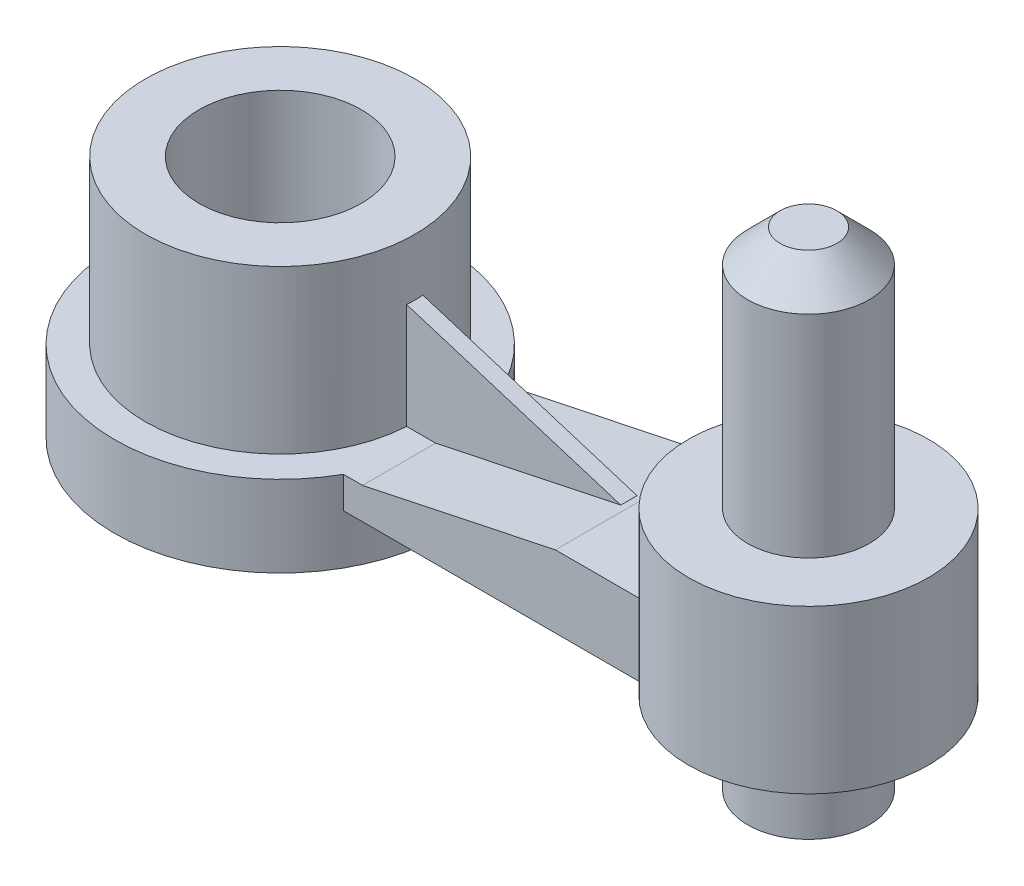
from build123d import *

# Parameters (mm, degrees)
CROQUIS1_R               = 8.295
CROQUIS1_R_2             = 5
SALIENTE_EXTRUIR1_DEPTH  = 10
CROQUIS2_R               = 10.195
SALIENTE_EXTRUIR2_DEPTH  = 5
CROQUIS5_R               = 3.745
SALIENTE_EXTRUIR3_DEPTH  = 2.5
CROQUIS6_R               = 7.385
SALIENTE_EXTRUIR4_DEPTH  = 10
CROQUIS7_R               = 3.745
CORTAR_EXTRUIR3_DEPTH    = 10
CROQUIS8_R               = 3.745
SALIENTE_EXTRUIR5_DEPTH  = 23
CROQUIS9_R               = 3.745
SALIENTE_EXTRUIR6_DEPTH  = 2
SALIENTE_EXTRUIR6_TAPER  = 45
SALIENTE_EXTRUIR16_DEPTH = 5
SALIENTE_EXTRUIR19_DEPTH = 0.5
SALIENTE_EXTRUIR20_DEPTH = 5


with BuildPart() as part:
    # Croquis1 → Saliente-Extruir1 (new body)
    with BuildSketch(Plane(origin=(0, 0, 0), x_dir=(1, 0, 0), z_dir=(0, 1, 0))):
        with Locations(Location((-17.319844218, -0.612730338, 0), (0, 0, 270))):
            Circle(CROQUIS1_R)
        with Locations(Location((-17.319844218, -0.612730338, 0), (0, 0, 270))):
            Circle(CROQUIS1_R_2, mode=Mode.SUBTRACT)
    extrude(amount=SALIENTE_EXTRUIR1_DEPTH)

    # Croquis2 → Saliente-Extruir2 (add)
    with BuildSketch(Plane.XZ):
        with Locations(Location((-17.319844218, 0.612730338, 0), (0, 0, 270))):
            Circle(CROQUIS2_R)
    extrude(amount=SALIENTE_EXTRUIR2_DEPTH)



with BuildPart() as body_2:
    # Croquis5 → Saliente-Extruir3 (new, symmetric)
    with BuildSketch(Plane.XZ.offset(5)):
        with Locations(Location((15.200155782, 0.612730338, 0), (0, 0, 270))):
            Circle(CROQUIS5_R)
    extrude(amount=SALIENTE_EXTRUIR3_DEPTH, both=True)

    # Croquis6 → Saliente-Extruir4 (add)
    with BuildSketch(Plane(origin=(0, -2.5, 0), x_dir=(1, 0, 0), z_dir=(0, 1, 0))):
        with Locations(Location((15.200155782, -0.612730338, 0), (0, 0, 270))):
            Circle(CROQUIS6_R)
    extrude(amount=SALIENTE_EXTRUIR4_DEPTH)

    # Croquis7 → Cortar-Extruir3 (cut)
    with BuildSketch(Plane.XZ.offset(2.5)):
        with Locations(Location((15.200155782, 0.612730338, 0), (0, 0, 270))):
            Circle(CROQUIS7_R)
    extrude(amount=-CORTAR_EXTRUIR3_DEPTH, mode=Mode.SUBTRACT)


with BuildPart() as cortar_extruir3_piece_1:
    # of the separate pieces the step leaves, piece 1, a body of its own (cortar_extruir3_pieces)
    add(body_2.part.solids().sort_by_distance((15.200155782, -2.5, 7.997730338))[0])



with BuildPart() as cortar_extruir3_piece_2:
    # of the separate pieces the step leaves, piece 2, a body of its own (cortar_extruir3_pieces)
    add(body_2.part.solids().sort_by_distance((15.200155782, -7.5, -3.132269662))[0])


with BuildPart() as cortar_extruir3_piece_1_1:
    add(cortar_extruir3_piece_1.part)

    add(cortar_extruir3_piece_2.part)  # Saliente-Extruir5 merges Cortar-Extruir3 piece 2
    # Croquis8 → Saliente-Extruir5 (add)
    with BuildSketch(Plane(origin=(0, -2.5, 0), x_dir=(1, 0, 0), z_dir=(0, 1, 0))):
        with Locations(Location((15.200155782, -0.612730338, 0), (0, 0, 270))):
            Circle(CROQUIS8_R)
    extrude(amount=SALIENTE_EXTRUIR5_DEPTH)


with BuildPart() as body_3:
    # Croquis9 → Saliente-Extruir6 (new body)
    with BuildSketch(Plane(origin=(0, 20.5, 0), x_dir=(1, 0, 0), z_dir=(0, 1, 0))):
        with Locations(Location((15.200155782, -0.612730338, 0), (0, 0, 270))):
            Circle(CROQUIS9_R)
    extrude(amount=SALIENTE_EXTRUIR6_DEPTH, taper=SALIENTE_EXTRUIR6_TAPER)


with BuildPart() as part_1:
    add(part.part)

    add(cortar_extruir3_piece_1_1.part)  # Saliente-Extruir16 merges Cortar-Extruir3 piece 1
    # Croquis20 → Saliente-Extruir16 (add, symmetric)
    with BuildSketch(Plane.XY.offset(0.61)):
        Polygon((-8.479007735, 0), (-8.479007735, -1.94), (9.975281452, -1.94), (9.975281452, 2.5), (4.620155782, 2.5), (-7.124844218, 0), align=None)
    extrude(amount=SALIENTE_EXTRUIR16_DEPTH, both=True)

    # Croquis21 → Saliente-Extruir19 (add, symmetric)
    with BuildSketch(Plane.XY.offset(0.61)):
        Polygon((-7.124844218, 0), (4.145155782, 2.398893146), (-9.024844218, 6.495848731), (-12.124187609, 7.46), (-12.124187609, 0), align=None)
    extrude(amount=SALIENTE_EXTRUIR19_DEPTH, both=True)

    # Croquis22 → Saliente-Extruir20 (add, symmetric)
    with BuildSketch(Plane.XY.offset(0.61)):
        Polygon((-8.433600865, 0), (-8.433600865, -1.94), (9.762737192, -1.94), (9.762737192, 2.5), (7.424161683, 2.5), (4.620155782, 2.5), (-7.257448558, 0), align=None)
    extrude(amount=SALIENTE_EXTRUIR20_DEPTH, both=True)


solid = Compound([body_3.part, part_1.part])
